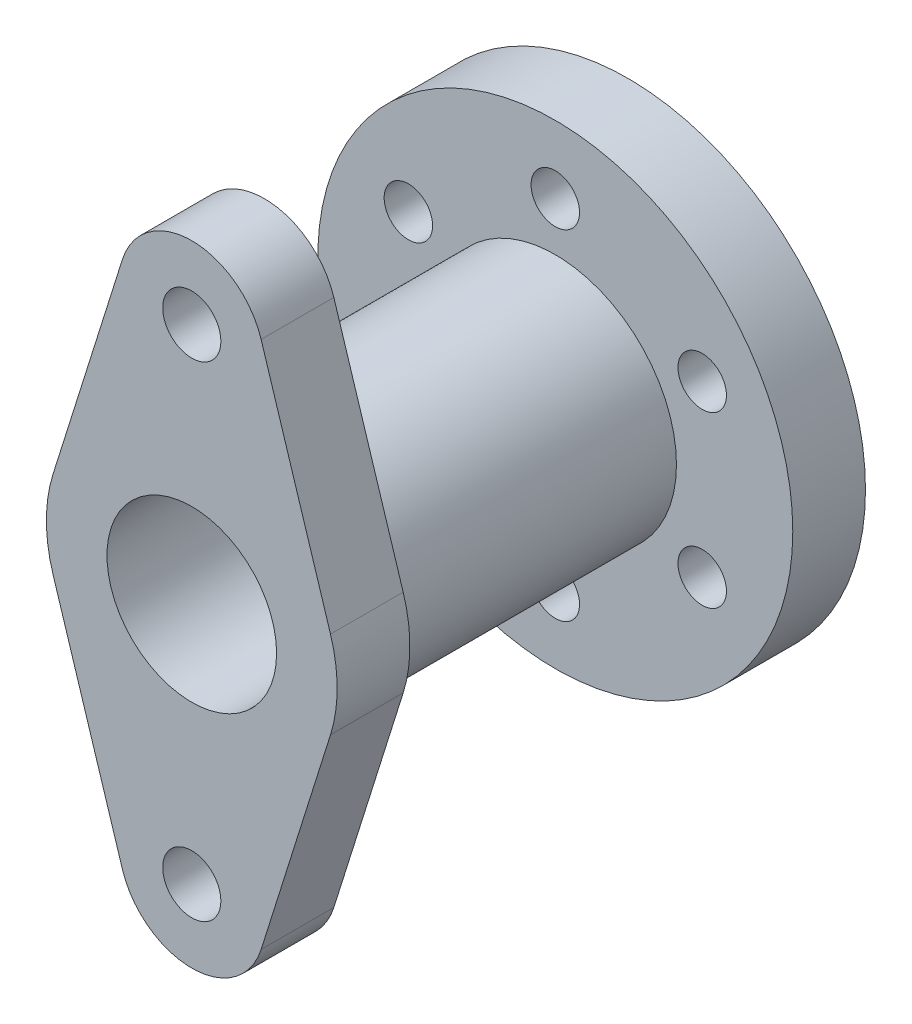
from build123d import *

# Parameters (mm, degrees)
SKETCH1_R           = 49
BOSS_EXTRUDE1_DEPTH = 15
SKETCH7_R           = 5
CUT_EXTRUDE1_DEPTH  = 71.901339903
SKETCH8_R           = 25
BOSS_EXTRUDE2_DEPTH = 60
BOSS_EXTRUDE3_DEPTH = 15
SKETCH11_R          = 6
CUT_EXTRUDE3_DEPTH  = 33
SKETCH11_3_R        = 6
SKETCH11_3_R_2      = 17.5
CUT_EXTRUDE4_DEPTH  = 30
SKETCH12_R          = 13
CUT_EXTRUDE5_DEPTH  = 60


with BuildPart() as part:
    # Sketch1 → Boss-Extrude1 (new body)
    with BuildSketch(Plane.XY):
        Circle(SKETCH1_R)
    extrude(amount=BOSS_EXTRUDE1_DEPTH)

    # Sketch7 → Cut-Extrude1 (cut, through all)
    with BuildSketch(Plane.XY.offset(15)):
        with Locations((0, 35)):
            Circle(SKETCH7_R)
        with Locations((30.310889132, 17.5)):
            Circle(SKETCH7_R)
        with Locations((30.310889132, -17.5)):
            Circle(SKETCH7_R)
        with Locations((0, -35)):
            Circle(SKETCH7_R)
        with Locations((-30.310889132, -17.5)):
            Circle(SKETCH7_R)
        with Locations((-30.310889132, 17.5)):
            Circle(SKETCH7_R)
    extrude(amount=-CUT_EXTRUDE1_DEPTH, mode=Mode.SUBTRACT)

    # Sketch8 → Boss-Extrude2 (add)
    with BuildSketch(Plane.XY.offset(15)):
        Circle(SKETCH8_R)
    extrude(amount=BOSS_EXTRUDE2_DEPTH)

    # Sketch10 → Boss-Extrude3 (add)
    with BuildSketch(Plane.XY.offset(75)):
        with BuildLine():
            Line((14.309088021, -54.5), (28.618175991, -9.000000163))
            ThreePointArc((28.618175991, -9.000000163), (30, -8.5e-08), (28.618176043, 9))
            Line((28.618176043, 9), (14.309088021, 54.5))
            ThreePointArc((14.309088021, 54.5), (0, 65), (-14.309088021, 54.5))
            Line((-14.309088021, 54.5), (-28.618176043, 9))
            ThreePointArc((-28.618176043, 9), (-30, 0), (-28.618176043, -9))
            Line((-28.618176043, -9), (-14.309088021, -54.5))
            ThreePointArc((-14.309088021, -54.5), (0, -65), (14.309088021, -54.5))
        make_face()
    extrude(amount=BOSS_EXTRUDE3_DEPTH)

    # Sketch11 → Cut-Extrude3 (cut)
    with BuildSketch(Plane.XY.offset(90)):
        with Locations((0, 50)):
            Circle(SKETCH11_R)
        with Locations((0, -50)):
            Circle(SKETCH11_R)
    extrude(amount=-CUT_EXTRUDE3_DEPTH, mode=Mode.SUBTRACT)

    # Sketch11<3> → Cut-Extrude4 (cut)
    with BuildSketch(Plane.XY.offset(90)):
        with Locations((0, 50)):
            Circle(SKETCH11_3_R)
        with Locations((0, -50)):
            Circle(SKETCH11_3_R)
        Circle(SKETCH11_3_R_2)
    extrude(amount=-CUT_EXTRUDE4_DEPTH, mode=Mode.SUBTRACT)

    # Sketch12 → Cut-Extrude5 (cut)
    with BuildSketch(Plane(origin=(0, 0, 0), x_dir=(-1, 0, 0), z_dir=(0, 0, -1))):
        Circle(SKETCH12_R)
    extrude(amount=-CUT_EXTRUDE5_DEPTH, mode=Mode.SUBTRACT)


solid = part.part
